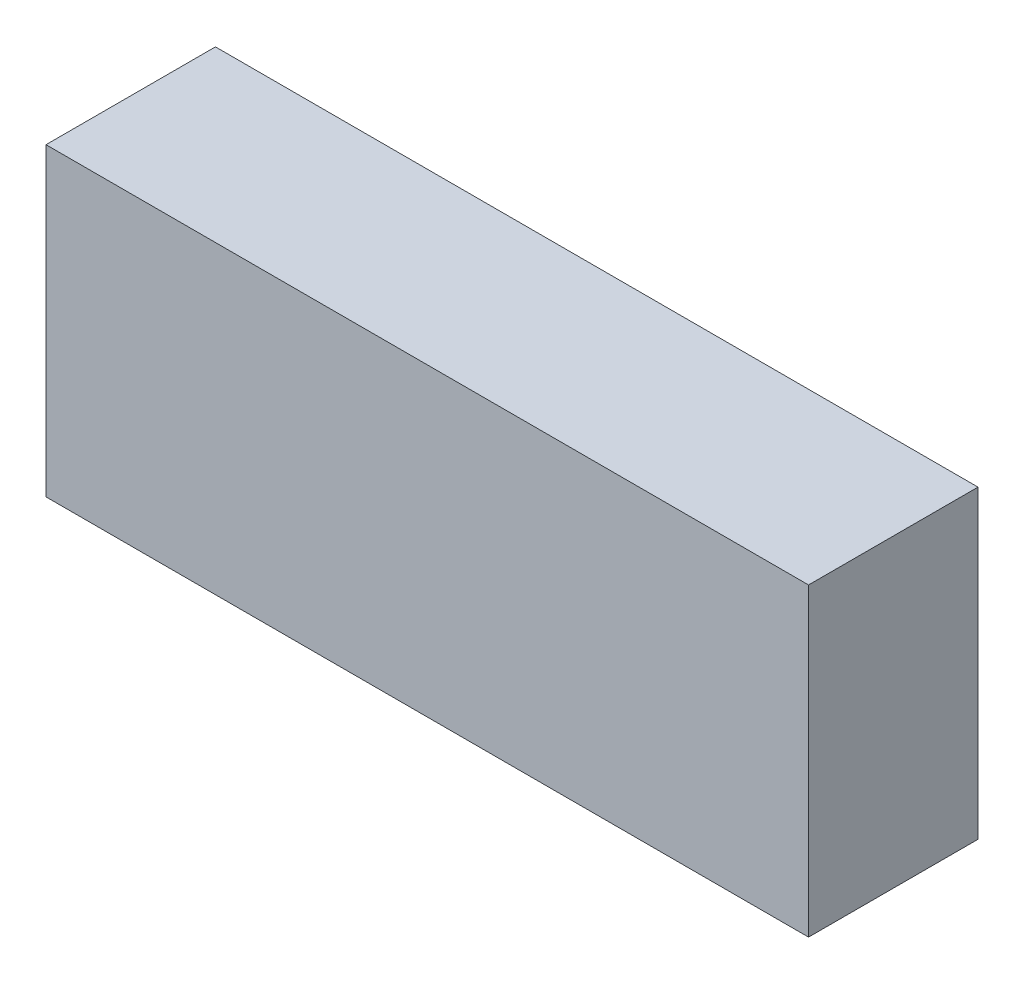
from build123d import *

# Parameters (mm, degrees)
SKETCH_1_W      = 45
SKETCH_1_H      = 18
EXTRUDE_1_DEPTH = 10


with BuildPart() as part:
    # 草图1 → 凸台-拉伸1 (new body)
    with BuildSketch(Plane.XY):
        with Locations((-6.721022928, 18.436825397)):
            Rectangle(SKETCH_1_W, SKETCH_1_H)
    extrude(amount=EXTRUDE_1_DEPTH)


solid = part.part
